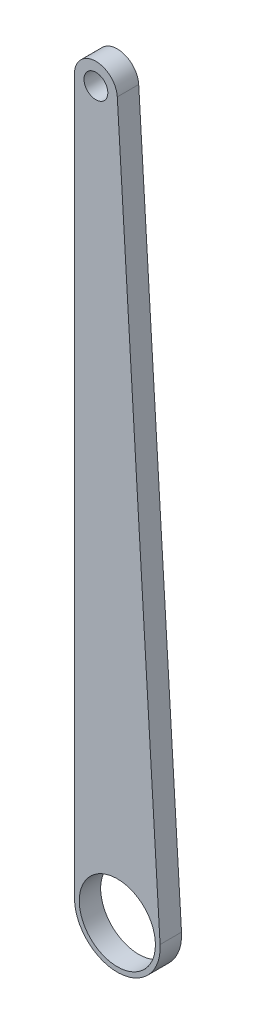
from build123d import *

# Parameters (mm, degrees)
SKETCH_1_R      = 2.5
SKETCH_1_R_2    = 8
EXTRUDE_1_DEPTH = 4.5


with BuildPart() as part:
    # 스케치1 → 보스-돌출1 (new body)
    with BuildSketch(Plane.XY):
        with BuildLine():
            Line((-9, 150), (-9, 0))
            ThreePointArc((-9, 0), (0.269878582, -8.995952732), (8.983814567, 0.539514437))
            Line((8.983814567, 0.539514437), (-0.008092717, 150.269757219))
            ThreePointArc((-0.008092717, 150.269757219), (-4.634939291, 154.497976366), (-9, 150))
        make_face()
        with Locations((-4.5, 150)):
            Circle(SKETCH_1_R, mode=Mode.SUBTRACT)
        Circle(SKETCH_1_R_2, mode=Mode.SUBTRACT)
    extrude(amount=EXTRUDE_1_DEPTH)


solid = part.part
